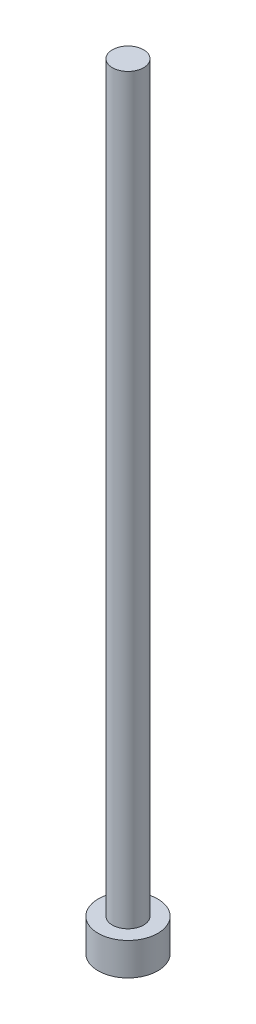
from build123d import *

# Parameters (mm, degrees)
SKETCH_1_R          = 2.2
EXTRUDE_1_DEPTH     = 2.4
EXTRUDE_START       = 2.4
SKETCH_1_4_R        = 1.15
EXTRUDE_2_DEPTH     = 54.8
CUT_EXTRUDE_1_DEPTH = 1.5


with BuildPart() as part:
    # 草图1 → 凸台-拉伸1 (new body)
    with BuildSketch(Plane(origin=(0, 0, 0), x_dir=(1, 0, 0), z_dir=(0, 1, 0))):
        with Locations(Location((0, 0, 0), (0, 0, 270))):
            Circle(SKETCH_1_R)
    extrude(amount=EXTRUDE_1_DEPTH)

    # 草图1<4> → 凸台-拉伸2 (add)
    with BuildSketch(Plane(origin=(0, 0, 0), x_dir=(1, 0, 0), z_dir=(0, 1, 0)).offset(EXTRUDE_START)):
        with Locations(Location((0, 0, 0), (0, 0, 90))):
            Circle(SKETCH_1_4_R)
    extrude(amount=EXTRUDE_2_DEPTH)

    # 草图1<3> → 切除-拉伸1 (cut)
    with BuildSketch(Plane(origin=(0, 0, 0), x_dir=(1, 0, 0), z_dir=(0, 1, 0))):
        with BuildLine():
            ThreePointArc((1.15, 0), (1.149992705, 0.004096081), (1.149970821, 0.008192111))
            Line((1.149970821, 0.008192111), (0.582079986, 0.991807889))
            ThreePointArc((0.582079986, 0.991807889), (0.575, 0.995929214), (0.567890835, 1))
            Line((0.567890835, 1), (-0.567890835, 1))
            ThreePointArc((-0.567890835, 1), (-0.575, 0.995929214), (-0.582079986, 0.991807889))
            Line((-0.582079986, 0.991807889), (-1.149970821, 0.008192111))
            ThreePointArc((-1.149970821, 0.008192111), (-1.15, 0), (-1.149970821, -0.008192111))
            Line((-1.149970821, -0.008192111), (-0.582079986, -0.991807889))
            ThreePointArc((-0.582079986, -0.991807889), (-0.575, -0.995929214), (-0.567890835, -1))
            Line((-0.567890835, -1), (0.567890835, -1))
            ThreePointArc((0.567890835, -1), (0.575, -0.995929214), (0.582079986, -0.991807889))
            Line((0.582079986, -0.991807889), (1.149970821, -0.008192111))
            ThreePointArc((1.149970821, -0.008192111), (1.149992705, -0.004096081), (1.15, 0))
        make_face()
    extrude(amount=CUT_EXTRUDE_1_DEPTH, mode=Mode.SUBTRACT)


solid = part.part
